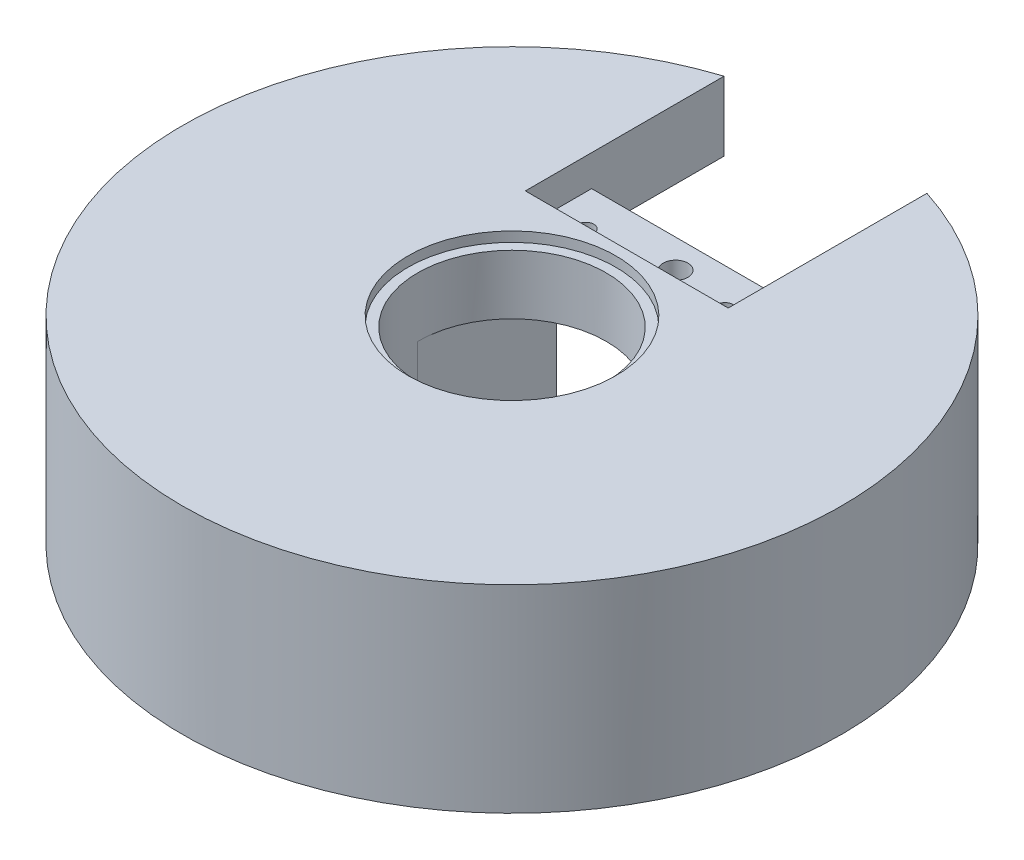
from build123d import *

# Parameters (mm, degrees)
SKETCH1_R           = 33.3
BOSS_EXTRUDE1_DEPTH = 20
CIRPATTERN1_COUNT   = 3
CUT_EXTRUDE1_DEPTH  = 13
CUT_EXTRUDE3_REACH  = 53.164
SKETCH6_R           = 9.525
CUT_EXTRUDE4_START  = -1
SKETCH6_4_R         = 10.5
SKETCH6_4_R_2       = 9.525
CUT_EXTRUDE4_DEPTH  = 1
SKETCH7_R           = 0.8
SKETCH7_R_2         = 1.25
CUT_EXTRUDE5_DEPTH  = 52.164245328
SKETCH8_W           = 20.5
SKETCH8_H           = 25
CUT_EXTRUDE6_DEPTH  = 3.15
CUT_EXTRUDE7_REACH  = 52.017
SKETCH9_W           = 20.5
SKETCH9_H           = 20


with BuildPart() as part:
    # Sketch1 → Boss-Extrude1 (new body)
    with BuildSketch(Plane(origin=(0, 0, 0), x_dir=(1, 0, 0), z_dir=(0, 1, 0))):
        Circle(SKETCH1_R)
    extrude(amount=BOSS_EXTRUDE1_DEPTH)

    # Sketch3 → Cut-Revolve7 (revolve, cut)
    with BuildSketch(Plane.XZ):
        with BuildLine():
            Line((2.5019, 18), (-2.5019, 18))
            ThreePointArc((-2.5019, 18), (0, 15.4981), (2.5019, 18))
        make_face()
    cut_revolve7 = revolve(axis=Axis((3.292813159, 0, 18), (-1, 0, 0)), mode=Mode.SUBTRACT)

    # CirPattern1: Cut-Revolve7 ×3 about axis
    cirpattern1_axis = Axis((0, 0, 0), (0, 1, 0))
    for i in range(1, CIRPATTERN1_COUNT):
        add(cut_revolve7.rotate(cirpattern1_axis, i * 360 / CIRPATTERN1_COUNT), mode=Mode.SUBTRACT)

    # Sketch5 → Cut-Extrude1 (cut)
    with BuildSketch(Plane.XZ):
        with BuildLine():
            Line((9.525, -14), (9.525, 0))
            ThreePointArc((9.525, 0), (0, 9.525), (-9.525, 0))
            Line((-9.525, 0), (-9.525, -14))
            Line((-9.525, -14), (-21.202606522, -25.677606522))
            ThreePointArc((-21.202606522, -25.677606522), (0, -33.3), (21.202606522, -25.677606522))
            Line((21.202606522, -25.677606522), (9.525, -14))
        make_face()
    extrude(amount=-CUT_EXTRUDE1_DEPTH, mode=Mode.SUBTRACT)

    # Sketch6 → Cut-Extrude3 (cut, up to next)
    with BuildSketch(Plane(origin=(0, 20, 0), x_dir=(1, 0, 0), z_dir=(0, 1, 0)), mode=Mode.PRIVATE) as cut_extrude3_sk1:
        Circle(SKETCH6_R)
    cut_extrude3_tool1 = extrude(cut_extrude3_sk1.sketch, amount=-CUT_EXTRUDE3_REACH, mode=Mode.PRIVATE) & part.part
    add(cut_extrude3_tool1.solids().sort_by_distance((0, 20, 0))[0], mode=Mode.SUBTRACT)

    # Sketch6<4> → Cut-Extrude4 (cut)
    with BuildSketch(Plane(origin=(0, 20, 0), x_dir=(1, 0, 0), z_dir=(0, 1, 0)).offset(CUT_EXTRUDE4_START)):
        Circle(SKETCH6_4_R)
        Circle(SKETCH6_4_R_2, mode=Mode.SUBTRACT)
    extrude(amount=CUT_EXTRUDE4_DEPTH, mode=Mode.SUBTRACT)

    # Sketch7 → Cut-Extrude5 (cut, through all)
    with BuildSketch(Plane(origin=(0, 20, 0), x_dir=(1, 0, 0), z_dir=(0, 1, 0))):
        with Locations((-7.03, 14.5)):
            Circle(SKETCH7_R)
        with Locations((7.03, 14.5)):
            Circle(SKETCH7_R)
        with Locations((1.13, 15.4)):
            Circle(SKETCH7_R_2)
    extrude(amount=-CUT_EXTRUDE5_DEPTH, mode=Mode.SUBTRACT)

    # Sketch8 → Cut-Extrude6 (cut)
    with BuildSketch(Plane(origin=(0, 20, 0), x_dir=(1, 0, 0), z_dir=(0, 1, 0))):
        with Locations((0, 24.1)):
            Rectangle(SKETCH8_W, SKETCH8_H)
    extrude(amount=-CUT_EXTRUDE6_DEPTH, mode=Mode.SUBTRACT)

    # Sketch9 → Cut-Extrude7 (cut, up to next)
    with BuildSketch(Plane(origin=(0, 16.85, 0), x_dir=(1, 0, 0), z_dir=(0, 1, 0)), mode=Mode.PRIVATE) as cut_extrude7_sk1:
        with Locations((0, 28.3)):
            Rectangle(SKETCH9_W, SKETCH9_H)
    cut_extrude7_tool1 = extrude(cut_extrude7_sk1.sketch, amount=-CUT_EXTRUDE7_REACH, mode=Mode.PRIVATE) & part.part
    add(cut_extrude7_tool1.solids().sort_by_distance((0, 16.85, -28.3))[0], mode=Mode.SUBTRACT)


solid = part.part
